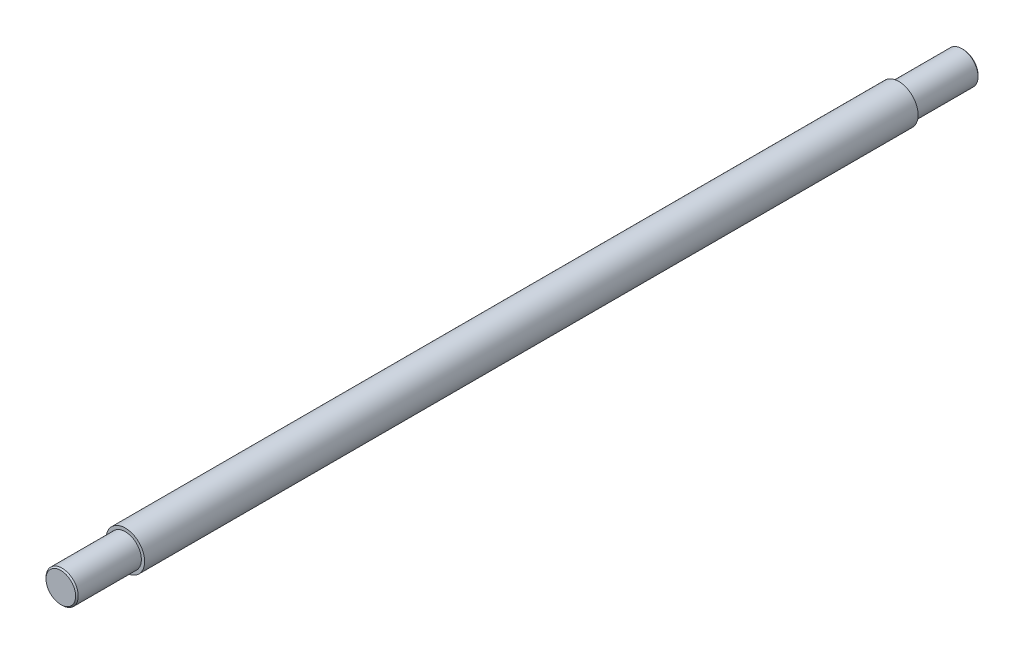
from build123d import *


with BuildPart() as part:
    # Sketch1 → Revolve1 (revolve)
    with BuildSketch(Plane.XZ, mode=Mode.PRIVATE) as revolve1_sk:
        Polygon((2.3, 70), (0, 70), (0, -70), (2.3, -70), (2.5, -69.8), (2.5, -60), (3, -60), (3, 60), (2.5, 60), (2.5, 69.8), align=None)
    revolve(revolve1_sk.sketch.rotate(Axis((0, 0, 70), (0, 0, -1)), 180), axis=Axis((0, 0, 70), (0, 0, -1)))


solid = part.part
